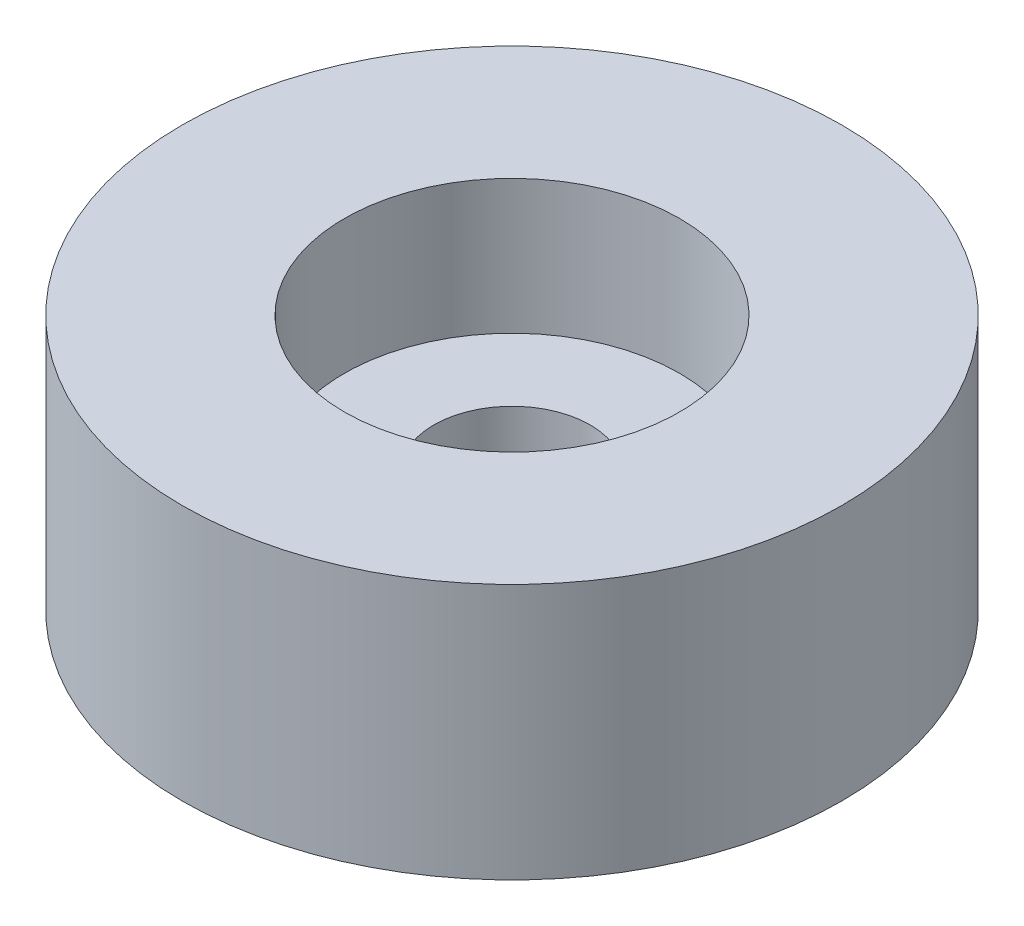
from build123d import *

# Parameters (mm, degrees)
SKETCH1_R           = 29.5
BOSS_EXTRUDE1_DEPTH = 22.9
CUT_EXTRUDE1_DEPTH  = 3
SKETCH3_R           = 7
CUT_EXTRUDE2_DEPTH  = 8
SKETCH4_R           = 15
CUT_EXTRUDE3_DEPTH  = 12


with BuildPart() as part:
    # Sketch1 → Boss-Extrude1 (new body)
    with BuildSketch(Plane(origin=(0, 0, 0), x_dir=(1, 0, 0), z_dir=(0, 1, 0))):
        with Locations(Location((0, 0, 0), (0, 0, 270))):
            Circle(SKETCH1_R)
    extrude(amount=BOSS_EXTRUDE1_DEPTH)

    # Sketch2 → Cut-Extrude1 (cut)
    with BuildSketch(Plane.XZ):
        Polygon((12.245869836, 12.245869836), (0, 17.318275205), (-12.245869836, 12.245869836), (-17.318275205, 0), (-12.245869836, -12.245869836), (0, -17.318275205), (12.245869836, -12.245869836), (17.318275205, 0), align=None)
    extrude(amount=-CUT_EXTRUDE1_DEPTH, mode=Mode.SUBTRACT)

    # Sketch3 → Cut-Extrude2 (cut)
    with BuildSketch(Plane.XZ.offset(-3)):
        with Locations(Location((0, 0, 0), (0, 0, 270))):
            Circle(SKETCH3_R)
    extrude(amount=-CUT_EXTRUDE2_DEPTH, mode=Mode.SUBTRACT)

    # Sketch4 → Cut-Extrude3 (cut)
    with BuildSketch(Plane(origin=(0, 22.9, 0), x_dir=(1, 0, 0), z_dir=(0, 1, 0))):
        with Locations(Location((0, 0, 0), (0, 0, 270))):
            Circle(SKETCH4_R)
    extrude(amount=-CUT_EXTRUDE3_DEPTH, mode=Mode.SUBTRACT)


solid = part.part
